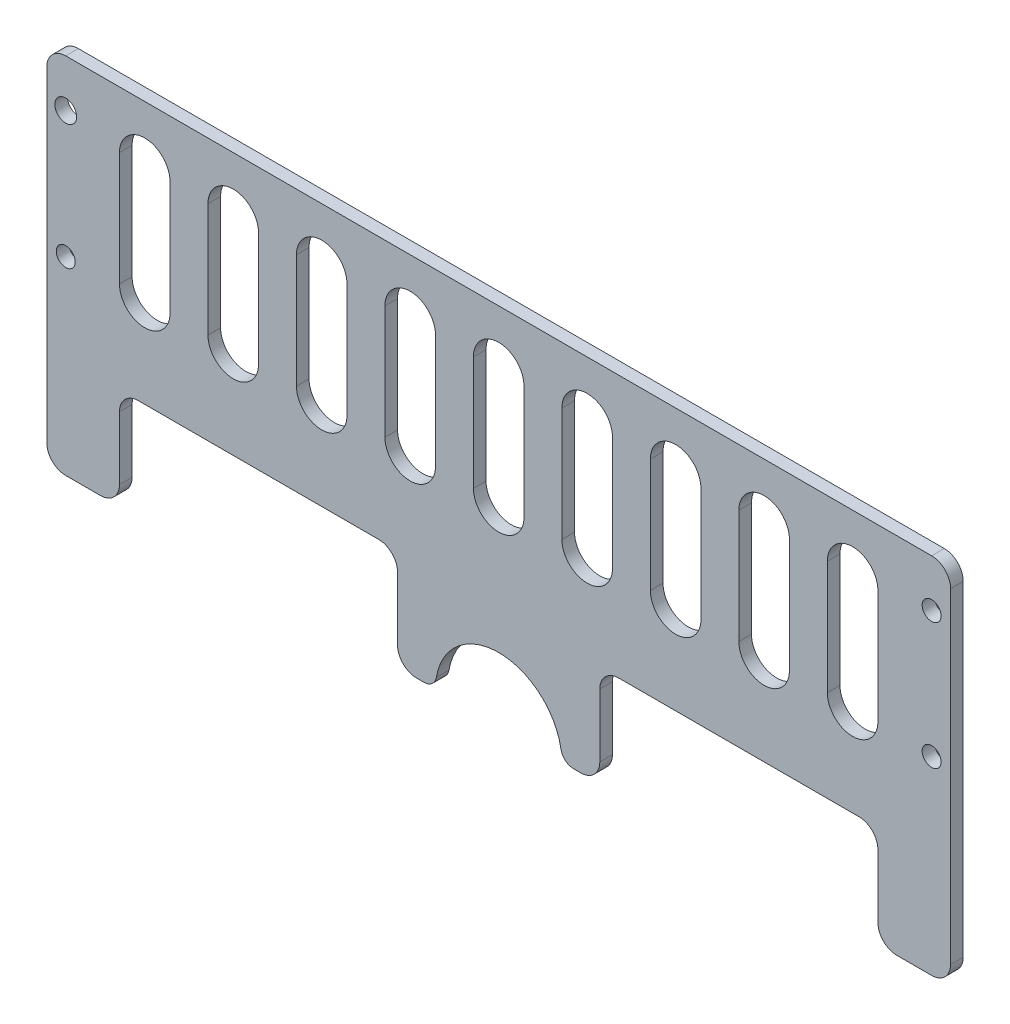
from build123d import *

# Parameters (mm, degrees)
SKETCH_1_W          = 143
SKETCH_1_H          = 57.5
EXTRUDE_1_DEPTH     = 2
SKETCH_4_W          = 120
SKETCH_4_H          = 16
CUT_EXTRUDE_1_DEPTH = 10
FILLET_1_R          = 3
CUT_EXTRUDE_2_DEPTH = 10
SKETCH_6_W          = 32
SKETCH_6_H          = 16
EXTRUDE_2_DEPTH     = 2
CUT_EXTRUDE_3_DEPTH = 2
FILLET_2_R          = 3
FILLET_3_R          = 2
SKETCH_8_R          = 1.5
CUT_EXTRUDE_4_DEPTH = 78.089639382
SKETCH_10_R         = 1.721982437
CUT_EXTRUDE_5_DEPTH = 78.089639382
SKETCH_12_R         = 1.5
CUT_EXTRUDE_6_DEPTH = 78.089639382


with BuildPart() as part:
    # 草图1 → 凸台-拉伸1 (new body)
    with BuildSketch(Plane.XY):
        Rectangle(SKETCH_1_W, SKETCH_1_H)
    extrude(amount=EXTRUDE_1_DEPTH)

    # 草图4 → 切除-拉伸1 (cut)
    with BuildSketch(Plane(origin=(0, 0, 0), x_dir=(-1, 0, 0), z_dir=(0, 0, -1))):
        with Locations((0, -20.75)):
            Rectangle(SKETCH_4_W, SKETCH_4_H)
    extrude(amount=-CUT_EXTRUDE_1_DEPTH, mode=Mode.SUBTRACT)

    # 圆角1
    fillet_1_edges = [part.edges().sort_by_distance(p)[0] for p in [
        (-60, -28.75, 1),
        (60, -28.75, 1),
        (-71.5, 28.75, 1),
        (71.5, 28.75, 1),
        (71.5, -28.75, 1),
        (-71.5, -28.75, 1),
    ]]
    fillet(fillet_1_edges, radius=FILLET_1_R)

    # 草图5 → 切除-拉伸2 (cut)
    with BuildSketch(Plane.XY.offset(2)):
        with BuildLine():
            Line((4, 19.75), (4, 1.75))
            ThreePointArc((4, 1.75), (0, -2.25), (-4, 1.75))
            Line((-4, 1.75), (-4, 19.75))
            ThreePointArc((-4, 19.75), (0, 23.75), (4, 19.75))
        make_face()
        with BuildLine():
            Line((18, 19.75), (18, 1.75))
            ThreePointArc((18, 1.75), (14, -2.25), (10, 1.75))
            Line((10, 1.75), (10, 19.75))
            ThreePointArc((10, 19.75), (14, 23.75), (18, 19.75))
        make_face()
        with BuildLine():
            Line((32, 19.75), (32, 1.75))
            ThreePointArc((32, 1.75), (28, -2.25), (24, 1.75))
            Line((24, 1.75), (24, 19.75))
            ThreePointArc((24, 19.75), (28, 23.75), (32, 19.75))
        make_face()
        with BuildLine():
            Line((46, 19.75), (46, 1.75))
            ThreePointArc((46, 1.75), (42, -2.25), (38, 1.75))
            Line((38, 1.75), (38, 19.75))
            ThreePointArc((38, 19.75), (42, 23.75), (46, 19.75))
        make_face()
        with BuildLine():
            Line((60, 19.75), (60, 1.75))
            ThreePointArc((60, 1.75), (56, -2.25), (52, 1.75))
            Line((52, 1.75), (52, 19.75))
            ThreePointArc((52, 19.75), (56, 23.75), (60, 19.75))
        make_face()
        with BuildLine():
            Line((-60, 19.75), (-60, 1.75))
            ThreePointArc((-60, 1.75), (-56, -2.25), (-52, 1.75))
            Line((-52, 1.75), (-52, 19.75))
            ThreePointArc((-52, 19.75), (-56, 23.75), (-60, 19.75))
        make_face()
        with BuildLine():
            Line((-46, 19.75), (-46, 1.75))
            ThreePointArc((-46, 1.75), (-42, -2.25), (-38, 1.75))
            Line((-38, 1.75), (-38, 19.75))
            ThreePointArc((-38, 19.75), (-42, 23.75), (-46, 19.75))
        make_face()
        with BuildLine():
            Line((-32, 19.75), (-32, 1.75))
            ThreePointArc((-32, 1.75), (-28, -2.25), (-24, 1.75))
            Line((-24, 1.75), (-24, 19.75))
            ThreePointArc((-24, 19.75), (-28, 23.75), (-32, 19.75))
        make_face()
        with BuildLine():
            Line((-18, 19.75), (-18, 1.75))
            ThreePointArc((-18, 1.75), (-14, -2.25), (-10, 1.75))
            Line((-10, 1.75), (-10, 19.75))
            ThreePointArc((-10, 19.75), (-14, 23.75), (-18, 19.75))
        make_face()
    extrude(amount=-CUT_EXTRUDE_2_DEPTH, mode=Mode.SUBTRACT)

    # 草图6 → 凸台-拉伸2 (add)
    with BuildSketch(Plane(origin=(0, 0, 0), x_dir=(-1, 0, 0), z_dir=(0, 0, -1))):
        with Locations((0, -20.75)):
            Rectangle(SKETCH_6_W, SKETCH_6_H)
    extrude(amount=-EXTRUDE_2_DEPTH)

    # 草图7 → 切除-拉伸3 (cut)
    with BuildSketch(Plane(origin=(0, 0, 0), x_dir=(-1, 0, 0), z_dir=(0, 0, -1))):
        with BuildLine():
            Line((-10, -28.75), (10, -28.75))
            ThreePointArc((10, -28.75), (0, -18.75), (-10, -28.75))
        make_face()
    extrude(amount=-CUT_EXTRUDE_3_DEPTH, mode=Mode.SUBTRACT)

    # 圆角2
    fillet_2_edges = [part.edges().sort_by_distance(p)[0] for p in [
        (-60, -12.75, 1),
        (60, -12.75, 1),
        (-16, -12.75, 1),
        (-16, -28.75, 1),
        (16, -28.75, 1),
        (16, -12.75, 1),
    ]]
    fillet(fillet_2_edges, radius=FILLET_2_R)

    # 圆角3
    fillet_3_edges = [part.edges().sort_by_distance(p)[0] for p in [
        (10, -28.75, 1),
        (-10, -28.75, 1),
    ]]
    fillet(fillet_3_edges, radius=FILLET_3_R)

    # 草图8 → 切除-拉伸4 (cut, through all)
    with BuildSketch(Plane(origin=(0, 0, 0), x_dir=(-1, 0, 0), z_dir=(0, 0, -1))):
        with Locations((-68.5, 1.25)):
            Circle(SKETCH_8_R)
        with Locations((-68.5, 21.25)):
            Circle(SKETCH_8_R)
    extrude(amount=-CUT_EXTRUDE_4_DEPTH, mode=Mode.SUBTRACT)

    # 草图10 → 切除-拉伸5 (cut, through all)
    with BuildSketch(Plane(origin=(0, 0, 0), x_dir=(-1, 0, 0), z_dir=(0, 0, -1))):
        with Locations((68.5, 21.25)):
            Circle(SKETCH_10_R)
    extrude(amount=-CUT_EXTRUDE_5_DEPTH, mode=Mode.SUBTRACT)

    # 草图12 → 切除-拉伸6 (cut, through all)
    with BuildSketch(Plane(origin=(0, 0, 0), x_dir=(-1, 0, 0), z_dir=(0, 0, -1))):
        with Locations((68.5, 1.25)):
            Circle(SKETCH_12_R)
    extrude(amount=-CUT_EXTRUDE_6_DEPTH, mode=Mode.SUBTRACT)


solid = part.part
